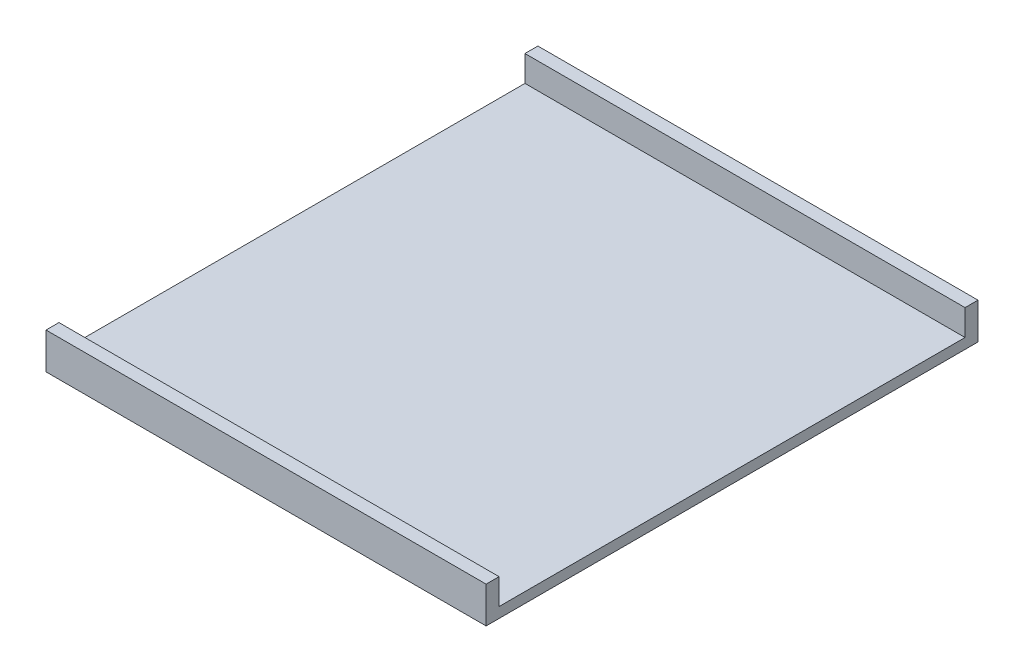
from build123d import *

# Parameters (mm, degrees)
EXTRUDE_1_DEPTH   = 30
EXTRUDE_1_2_DEPTH = 30
EXTRUDE_2_DEPTH   = 4
EXTRUDE_3_DEPTH   = 10


with BuildPart() as part:
    # 草图1 → 凸台-拉伸1 (new body)
    with BuildSketch(Plane.XY):
        Polygon((-55, 0), (-55, 3), (-57.5, 3), (-57.5, 6), (-62.5, 6), (-62.5, 3), (-65, 3), (-65, 0), align=None)
    extrude(amount=EXTRUDE_1_DEPTH)



with BuildPart() as body_2:
    # 草图1 → Extrude 1 2 (new body)
    with BuildSketch(Plane.XY):
        Polygon((65, 0), (55, 0), (55, 3), (57.5, 3), (57.5, 6), (62.5, 6), (62.5, 3), (65, 3), align=None)
    extrude(amount=EXTRUDE_1_2_DEPTH)


with BuildPart() as part_1:
    add(part.part)

    add(body_2.part)  # 凸台-拉伸2 merges body 2
    # 草图2 → 凸台-拉伸2 (add)
    with BuildSketch(Plane(origin=(0, 6, 0), x_dir=(1, 0, 0), z_dir=(0, 1, 0))):
        Polygon((0, -110), (-85, -110), (-85, 80), (85, 80), (85, -110), align=None)
    extrude(amount=EXTRUDE_2_DEPTH)

    # 草图3 → 凸台-拉伸3 (add)
    with BuildSketch(Plane(origin=(0, 10, 0), x_dir=(1, 0, 0), z_dir=(0, 1, 0))):
        Polygon((-85, 80), (-85, 75), (80, 75), (85, 75), (85, 80), align=None)
        Polygon((80, -105), (-85, -105), (-85, -110), (85, -110), (85, -105), align=None)
    extrude(amount=EXTRUDE_3_DEPTH)


solid = part_1.part
